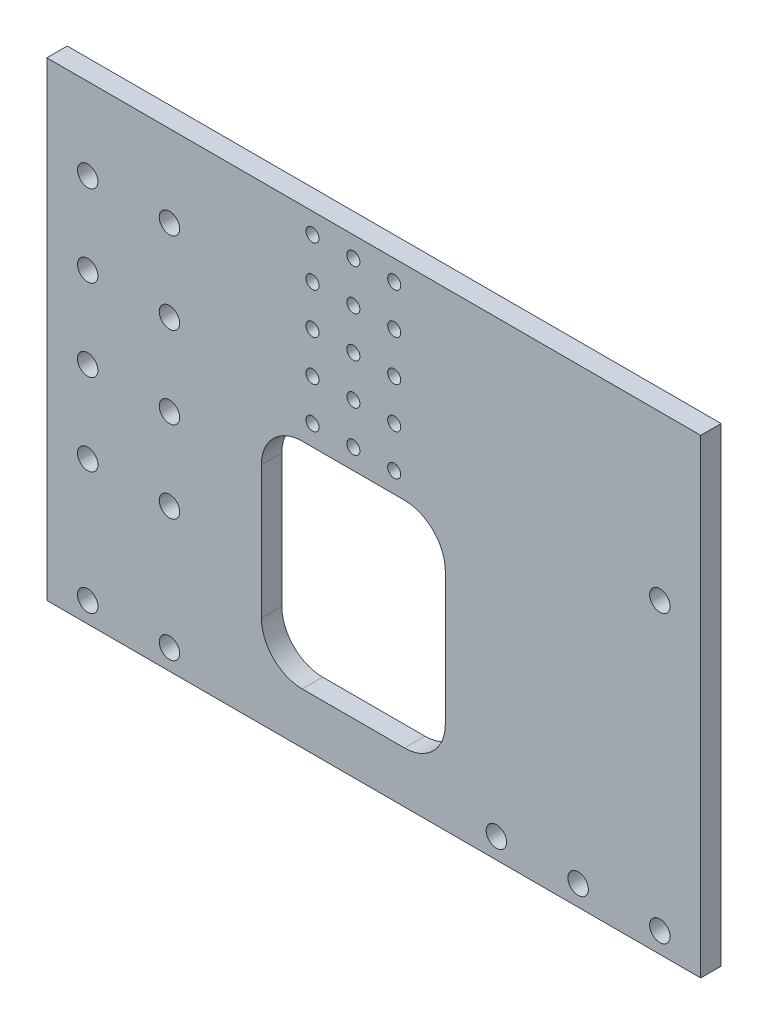
from build123d import *

# Parameters (mm, degrees)
SKETCH1_W               = 203.2
SKETCH1_H               = 146.05
BOSS_EXTRUDE1_DEPTH     = 6.35
CUT_EXTRUDE1_DEPTH      = 251.322122474
CUT_EXTRUDE1_DEPTH_BACK = 251.322122474
SKETCH2_R               = 3.175
CUT_EXTRUDE2_DEPTH      = 251.322122474
CUT_EXTRUDE2_DEPTH_BACK = 251.322122474
SKETCH3_R               = 2.032
CUT_EXTRUDE3_DEPTH      = 251.322122474
CUT_EXTRUDE3_DEPTH_BACK = 251.322122474
SKETCH4_W               = 57.15
SKETCH4_H               = 66.675
FILLET1_R               = 12.7


with BuildPart() as part:
    # Sketch1 → Boss-Extrude1 (new body)
    with BuildSketch(Plane.XY):
        with Locations((101.6, 73.025)):
            Rectangle(SKETCH1_W, SKETCH1_H)
    extrude(amount=BOSS_EXTRUDE1_DEPTH)

    # Sketch2 → Cut-Extrude1 (cut, two sides: drawn at the far end of the back side and taken through both)
    with BuildSketch(Plane.XY.offset(6.35).offset(-CUT_EXTRUDE1_DEPTH_BACK)):
        with Locations((12.7, 6.35)):
            Circle(SKETCH2_R)
        with Locations((38.1, 6.35)):
            Circle(SKETCH2_R)
        with Locations((12.7, 95.25)):
            Circle(SKETCH2_R)
        with Locations((38.1, 95.25)):
            Circle(SKETCH2_R)
        with Locations((190.5, 95.25)):
            Circle(SKETCH2_R)
        with Locations((190.5, 6.35)):
            Circle(SKETCH2_R)
        with Locations((12.7, 69.85)):
            Circle(SKETCH2_R)
        with Locations((38.1, 69.85)):
            Circle(SKETCH2_R)
        with Locations((12.7, 44.45)):
            Circle(SKETCH2_R)
        with Locations((38.1, 44.45)):
            Circle(SKETCH2_R)
        with Locations((12.7, 120.65)):
            Circle(SKETCH2_R)
        with Locations((38.1, 120.65)):
            Circle(SKETCH2_R)
        with Locations((165.1, 6.35)):
            Circle(SKETCH2_R)
        with Locations((139.7, 6.35)):
            Circle(SKETCH2_R)
    extrude(amount=CUT_EXTRUDE1_DEPTH + CUT_EXTRUDE1_DEPTH_BACK, mode=Mode.SUBTRACT)

    # Sketch3 → Cut-Extrude2 (cut, two sides: drawn at the far end of the back side and taken through both)
    with BuildSketch(Plane.XY.offset(6.35).offset(-CUT_EXTRUDE2_DEPTH_BACK)):
        with Locations((95.25, 139.7)):
            Circle(SKETCH3_R)
        with Locations((107.95, 139.7)):
            Circle(SKETCH3_R)
        with Locations((82.55, 139.7)):
            Circle(SKETCH3_R)
        with Locations((107.95, 127)):
            Circle(SKETCH3_R)
        with Locations((95.25, 127)):
            Circle(SKETCH3_R)
        with Locations((82.55, 127)):
            Circle(SKETCH3_R)
        with Locations((107.95, 114.3)):
            Circle(SKETCH3_R)
        with Locations((95.25, 114.3)):
            Circle(SKETCH3_R)
        with Locations((82.55, 114.3)):
            Circle(SKETCH3_R)
        with Locations((107.95, 101.6)):
            Circle(SKETCH3_R)
        with Locations((95.25, 101.6)):
            Circle(SKETCH3_R)
        with Locations((82.55, 101.6)):
            Circle(SKETCH3_R)
        with Locations((107.95, 88.9)):
            Circle(SKETCH3_R)
        with Locations((95.25, 88.9)):
            Circle(SKETCH3_R)
        with Locations((82.55, 88.9)):
            Circle(SKETCH3_R)
    extrude(amount=CUT_EXTRUDE2_DEPTH + CUT_EXTRUDE2_DEPTH_BACK, mode=Mode.SUBTRACT)

    # Sketch4 → Cut-Extrude3 (cut, two sides: drawn at the far end of the back side and taken through both)
    with BuildSketch(Plane.XY.offset(6.35).offset(-CUT_EXTRUDE3_DEPTH_BACK)):
        with Locations((95.25, 49.2125)):
            Rectangle(SKETCH4_W, SKETCH4_H)
    extrude(amount=CUT_EXTRUDE3_DEPTH + CUT_EXTRUDE3_DEPTH_BACK, mode=Mode.SUBTRACT)

    # Fillet1
    fillet1_edges = [part.edges().sort_by_distance(p)[0] for p in [
        (66.675, 15.875, 3.175),
        (66.675, 82.55, 3.175),
        (123.825, 82.55, 3.175),
        (123.825, 15.875, 3.175),
    ]]
    fillet(fillet1_edges, radius=FILLET1_R)


solid = part.part
